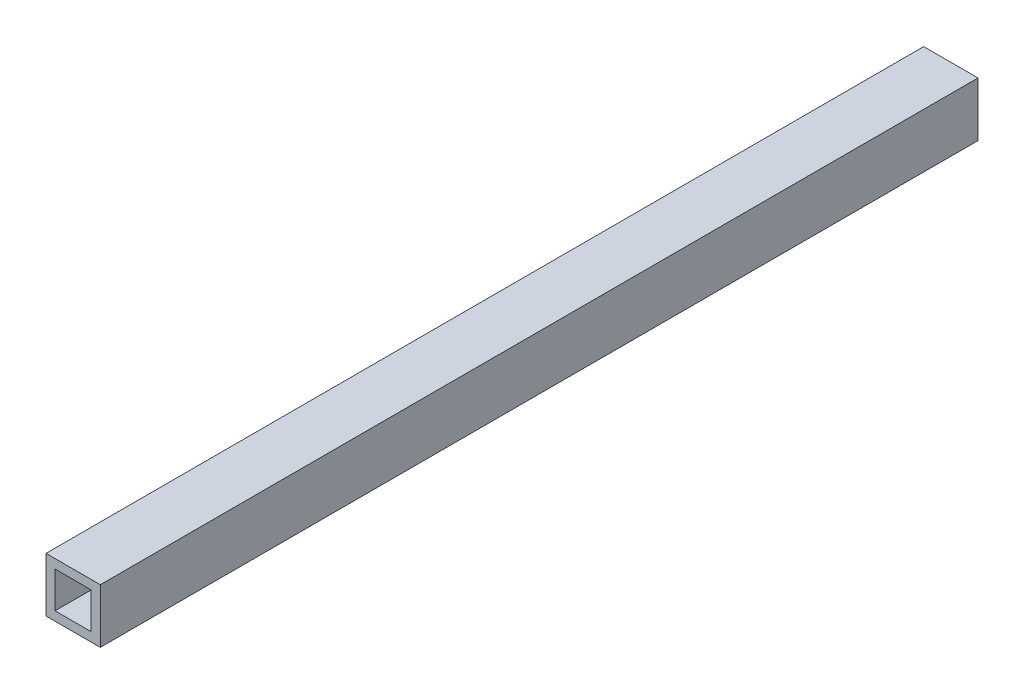
from build123d import *

# Parameters (mm, degrees)
SKETCH1_W           = 19.05
SKETCH1_H           = 19.05
SKETCH1_W_2         = 12.7
SKETCH1_H_2         = 12.7
BOSS_EXTRUDE1_DEPTH = 153.9875


with BuildPart() as part:
    # Sketch1 → Boss-Extrude1 (new, symmetric)
    with BuildSketch(Plane.XY):
        Rectangle(SKETCH1_W, SKETCH1_H)
        Rectangle(SKETCH1_W_2, SKETCH1_H_2, mode=Mode.SUBTRACT)
    extrude(amount=BOSS_EXTRUDE1_DEPTH, both=True)


solid = part.part
